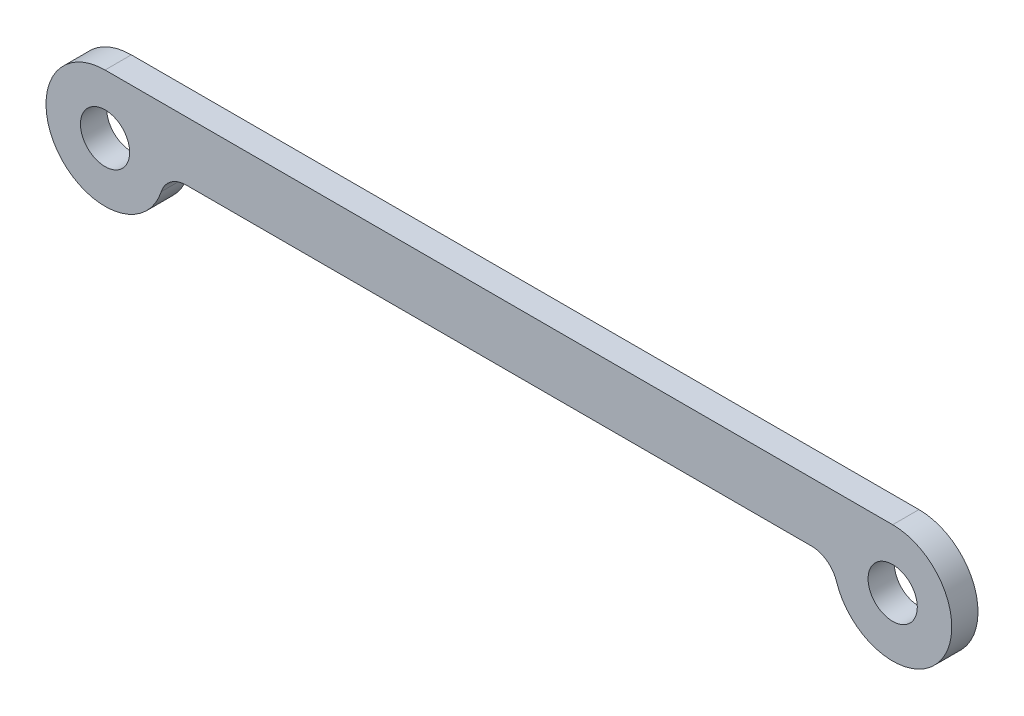
from build123d import *

# Parameters (mm, degrees)
SKETCH1_R           = 1.875
BOSS_EXTRUDE1_DEPTH = 2


with BuildPart() as part:
    # Sketch1 → Boss-Extrude1 (new body)
    with BuildSketch(Plane.XY):
        with BuildLine():
            Line((0, 4.5), (60, 4.5))
            ThreePointArc((60, 4.5), (63.63873393, -2.647567824), (55.718313389, -1.384615385))
            ThreePointArc((55.718313389, -1.384615385), (54.992038372, -0.38278492), (53.815341562, 0))
            Line((53.815341562, 0), (6.184658438, 0))
            ThreePointArc((6.184658438, 0), (5.007961628, -0.38278492), (4.281686611, -1.384615385))
            ThreePointArc((4.281686611, -1.384615385), (-3.63873393, -2.647567824), (0, 4.5))
        make_face()
        Circle(SKETCH1_R, mode=Mode.SUBTRACT)
        with Locations((60, 0)):
            Circle(SKETCH1_R, mode=Mode.SUBTRACT)
    extrude(amount=BOSS_EXTRUDE1_DEPTH)


solid = part.part
